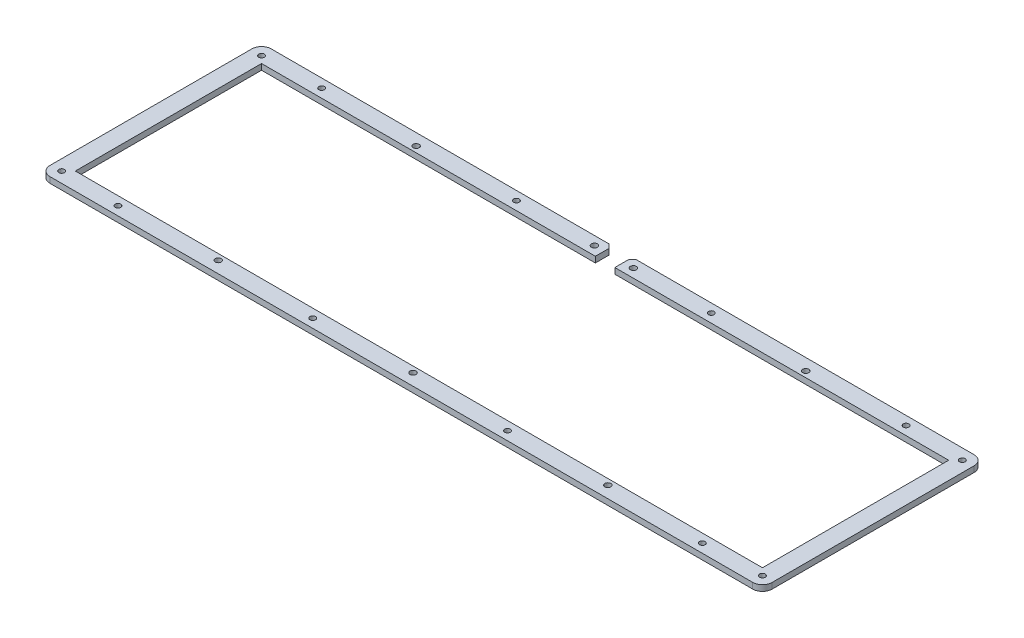
from build123d import *

# Parameters (mm, degrees)
SKETCH1_R           = 1.45
SKETCH1_R_2         = 1.55
BOSS_EXTRUDE1_DEPTH = 3


with BuildPart() as part:
    # Sketch1 → Boss-Extrude1 (new body)
    with BuildSketch(Plane(origin=(0, 0, 0), x_dir=(1, 0, 0), z_dir=(0, 1, 0))):
        with BuildLine():
            Line((6.611e-06, 108.600000663), (6.611e-06, 5.000000663))
            ThreePointArc((6.611e-06, 5.000000663), (1.464472705, 1.464466757), (5.000006611, 6.63e-07))
            Line((5.000006611, 6.63e-07), (365.775006611, 6.63e-07))
            ThreePointArc((365.775006611, 6.63e-07), (369.310540517, 1.464466757), (370.775006611, 5.000000663))
            Line((370.775006611, 5.000000663), (370.775006611, 108.600000663))
            ThreePointArc((370.775006611, 108.600000663), (369.310540517, 112.135534569), (365.775006611, 113.600000663))
            Line((365.775006611, 113.600000663), (192.387506611, 113.600000663))
            Line((192.387506611, 113.600000663), (190.387506611, 111.600000663))
            Line((190.387506611, 111.600000663), (190.387506611, 104.600000663))
            Line((190.387506611, 104.600000663), (361.775006611, 104.600000663))
            Line((361.775006611, 104.600000663), (361.775006611, 9.000000663))
            Line((361.775006611, 9.000000663), (9.000006611, 9.000000663))
            Line((9.000006611, 9.000000663), (9.000006611, 104.600000663))
            Line((9.000006611, 104.600000663), (180.387506611, 104.600000663))
            Line((180.387506611, 104.600000663), (180.387506611, 111.600000663))
            Line((180.387506611, 111.600000663), (178.387506611, 113.600000663))
            Line((178.387506611, 113.600000663), (5.000006611, 113.600000663))
            ThreePointArc((5.000006611, 113.600000663), (1.464472705, 112.135534569), (6.611e-06, 108.600000663))
        make_face()
        with Locations(Location((35.387506611, 4.500000663, 0), (0, 0, 270))):
            Circle(SKETCH1_R, mode=Mode.SUBTRACT)
        with Locations(Location((135.387506611, 4.500000663, 0), (0, 0, 270))):
            Circle(SKETCH1_R, mode=Mode.SUBTRACT)
        with Locations(Location((335.387506611, 4.500000663, 0), (0, 0, 270))):
            Circle(SKETCH1_R, mode=Mode.SUBTRACT)
        with Locations(Location((235.387506611, 4.500000663, 0), (0, 0, 270))):
            Circle(SKETCH1_R, mode=Mode.SUBTRACT)
        with Locations(Location((35.387506611, 109.100000663, 0), (0, 0, 270))):
            Circle(SKETCH1_R, mode=Mode.SUBTRACT)
        with Locations(Location((135.387506611, 109.100000663, 0), (0, 0, 270))):
            Circle(SKETCH1_R, mode=Mode.SUBTRACT)
        with Locations(Location((335.387506611, 109.100000663, 0), (0, 0, 270))):
            Circle(SKETCH1_R, mode=Mode.SUBTRACT)
        with Locations(Location((235.387506611, 109.100000663, 0), (0, 0, 270))):
            Circle(SKETCH1_R, mode=Mode.SUBTRACT)
        with Locations(Location((195.387506611, 109.100000663, 0), (0, 0, 270))):
            Circle(SKETCH1_R_2, mode=Mode.SUBTRACT)
        with Locations(Location((175.387506611, 109.100000663, 0), (0, 0, 270))):
            Circle(SKETCH1_R_2, mode=Mode.SUBTRACT)
        with Locations(Location((5.500006611, 108.100000663, 0), (0, 0, 270))):
            Circle(SKETCH1_R, mode=Mode.SUBTRACT)
        with Locations(Location((5.500006611, 5.500000663, 0), (0, 0, 270))):
            Circle(SKETCH1_R, mode=Mode.SUBTRACT)
        with Locations(Location((365.275006611, 5.500000663, 0), (0, 0, 270))):
            Circle(SKETCH1_R, mode=Mode.SUBTRACT)
        with Locations(Location((365.275006611, 108.100000663, 0), (0, 0, 270))):
            Circle(SKETCH1_R, mode=Mode.SUBTRACT)
        with Locations(Location((85.387506611, 107.600000663, 0), (0, 0, 270))):
            Circle(SKETCH1_R_2, mode=Mode.SUBTRACT)
        with Locations(Location((285.387506611, 107.600000663, 0), (0, 0, 270))):
            Circle(SKETCH1_R_2, mode=Mode.SUBTRACT)
        with Locations(Location((85.387506611, 6.000000663, 0), (0, 0, 270))):
            Circle(SKETCH1_R_2, mode=Mode.SUBTRACT)
        with Locations(Location((185.387506611, 6.000000663, 0), (0, 0, 270))):
            Circle(SKETCH1_R_2, mode=Mode.SUBTRACT)
        with Locations(Location((285.387506611, 6.000000663, 0), (0, 0, 270))):
            Circle(SKETCH1_R_2, mode=Mode.SUBTRACT)
    extrude(amount=-BOSS_EXTRUDE1_DEPTH)


solid = part.part
